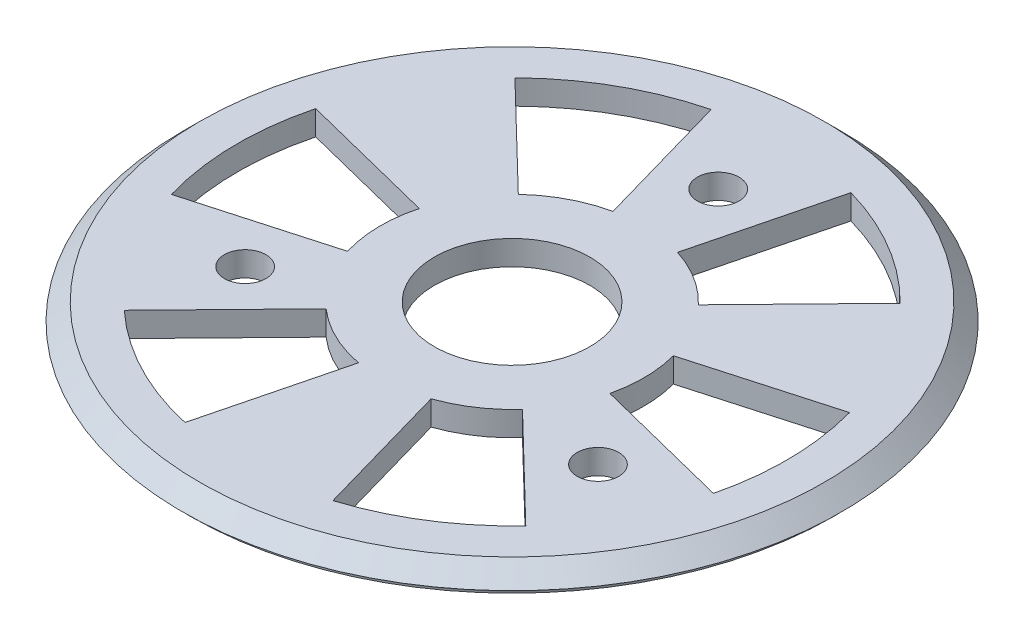
from build123d import *

# Parameters (mm, degrees)
SKETCH2_R           = 9.5
BOSS_EXTRUDE1_DEPTH = 3
SKETCH3_R           = 2.4765
BOSS_EXTRUDE2_DEPTH = 6
SKETCH5_R           = 2.54
CUT_EXTRUDE1_DEPTH  = 3


with BuildPart() as part:
    # Sketch1 → Revolve1 (revolve)
    with BuildSketch(Plane.XY, mode=Mode.PRIVATE) as revolve1_sk:
        with BuildLine():
            Line((-3, 3), (-3, 0))
            Line((-3, 0), (2.833330973, 0))
            ThreePointArc((2.833330973, 0), (3.099026965, 0.641446866), (3.74047383, 0.907142857))
            Line((3.74047383, 0.907142857), (1.647616688, 3))
            Line((1.647616688, 3), (-3, 3))
        make_face()
    revolve(revolve1_sk.sketch.rotate(Axis((-36.536669027, 18.916479231, 0), (0, -1, 0)), 180), axis=Axis((-36.536669027, 18.916479231, 0), (0, -1, 0)))

    # Sketch2 → Boss-Extrude1 (add)
    with BuildSketch(Plane(origin=(0, 0, 0), x_dir=(1, 0, 0), z_dir=(0, 1, 0))):
        with BuildLine():
            Line((-20.867712208, -3.717876844), (-3.835179752, -7.99934189))
            ThreePointArc((-3.835179752, -7.99934189), (-6.912459925, -15.993220643), (-11.907531207, -22.951741583))
            Line((-11.907531207, -22.951741583), (-24.531535953, -10.733852798))
            ThreePointArc((-24.531535953, -10.733852798), (-27.594601894, -13.393216618), (-31.225026168, -15.202804549))
            Line((-31.225026168, -15.202804549), (-26.411510933, -32.106978136))
            ThreePointArc((-26.411510933, -32.106978136), (-35.048905375, -33.632773165), (-43.787287916, -32.875604894))
            Line((-43.787287916, -32.875604894), (-39.473539012, -15.833938572))
            ThreePointArc((-39.473539012, -15.833938572), (-43.573178883, -14.485383842), (-47.167458429, -12.096492578))
            Line((-47.167458429, -12.096492578), (-59.432790875, -24.680852412))
            ThreePointArc((-59.432790875, -24.680852412), (-65.164474953, -17.715123462), (-68.840755241, -9.47749362))
            Line((-68.840755241, -9.47749362), (-51.939863017, -4.698981901))
            ThreePointArc((-51.939863017, -4.698981901), (-52.638650424, -0.254972715), (-52.080918658, 4.208933284))
            Line((-52.080918658, 4.208933284), (-69.114911822, 8.487341623))
            ThreePointArc((-69.114911822, 8.487341623), (-65.689685641, 16.836819584), (-60.169485242, 23.976381487))
            Line((-60.169485242, 23.976381487), (-47.536935944, 11.761502615))
            ThreePointArc((-47.536935944, 11.761502615), (-44.010986284, 14.264410171), (-39.946180469, 15.738934136))
            Line((-39.946180469, 15.738934136), (-44.764676694, 32.64470495))
            ThreePointArc((-44.764676694, 32.64470495), (-36.044934422, 33.662071661), (-27.358629805, 32.390437902))
            Line((-27.358629805, 32.390437902), (-31.667700916, 15.350308321))
            ThreePointArc((-31.667700916, 15.350308321), (-27.981833761, 13.643812135), (-24.840179389, 11.069369727))
            Line((-24.840179389, 11.069369727), (-12.58348556, 23.656328398))
            ThreePointArc((-12.58348556, 23.656328398), (-7.387085692, 16.842762923), (-4.079178242, 8.938017868))
            Line((-4.079178242, 8.938017868), (-20.977889223, 4.154899158))
            ThreePointArc((-20.977889223, 4.154899158), (-20.434245789, 0.225348329), (-20.867712208, -3.717876844))
        make_face()
        with Locations(Location((-36.536669027, 0, 0), (0, 0, 180))):
            Circle(SKETCH2_R, mode=Mode.SUBTRACT)
    extrude(amount=BOSS_EXTRUDE1_DEPTH)

    # Sketch3 → Boss-Extrude2 (add)
    with BuildSketch(Plane(origin=(0, 3, 0), x_dir=(1, 0, 0), z_dir=(0, 1, 0))):
        with Locations(Location((-35.151038514, -24.531821511, 0), (0, 0, 180))):
            Circle(SKETCH3_R)
        with Locations(Location((-56.941625658, 11.951020157, 0), (0, 0, 180))):
            Circle(SKETCH3_R)
        with Locations(Location((-14.451264399, 12.580801354, 0), (0, 0, 180))):
            Circle(SKETCH3_R)
    extrude(amount=-BOSS_EXTRUDE2_DEPTH)

    # Sketch5 → Cut-Extrude1 (cut)
    with BuildSketch(Plane(origin=(0, 3, 0), x_dir=(1, 0, 0), z_dir=(0, 1, 0))):
        with Locations(Location((-35.8782472, 24.531821511, 0), (0, 0, 180))):
            Circle(SKETCH5_R)
        with Locations(Location((-14.087660056, -11.951020157, 0), (0, 0, 180))):
            Circle(SKETCH5_R)
        with Locations(Location((-56.578021315, -12.580801354, 0), (0, 0, 180))):
            Circle(SKETCH5_R)
    extrude(amount=-CUT_EXTRUDE1_DEPTH, mode=Mode.SUBTRACT)


solid = part.part
